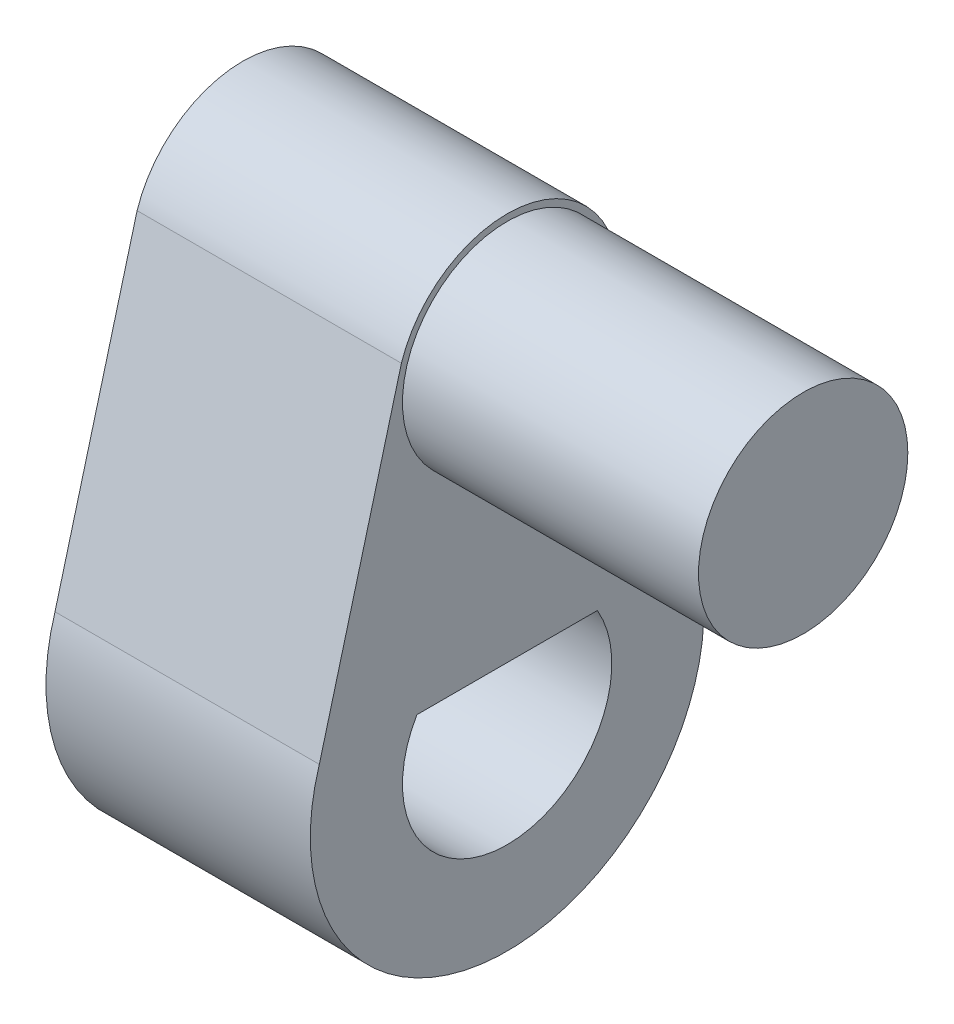
from build123d import *

# Parameters (mm, degrees)
BOSS_EXTRUDE2_DEPTH = 2.5
SKETCH4_R           = 0.99
CUT_EXTRUDE2_DEPTH  = 64.988660757
SKETCH6_R           = 0.99
BOSS_EXTRUDE4_DEPTH = 2.8
SKETCH7_W           = 2.01987101
SKETCH7_H           = 0.78494751
BOSS_EXTRUDE5_DEPTH = 2.5


with BuildPart() as part:
    # Sketch3 → Boss-Extrude2 (new body)
    with BuildSketch(Plane(origin=(0, 0, 0), x_dir=(0, 0, -1), z_dir=(1, 0, 0))):
        with BuildLine():
            Line((-54.67077374, 30.968825597), (-55.447230875, 28.071048118))
            ThreePointArc((-55.447230875, 28.071048118), (-53.67077374, 25.652507451), (-51.894316605, 28.071048118))
            Line((-51.894316605, 28.071048118), (-52.67077374, 30.968825597))
            ThreePointArc((-52.67077374, 30.968825597), (-53.67077374, 31.692969852), (-54.67077374, 30.968825597))
        make_face()
    extrude(amount=BOSS_EXTRUDE2_DEPTH)

    # Sketch4 → Cut-Extrude2 (cut, through all)
    with BuildSketch(Plane(origin=(2.5, 0, 0), x_dir=(0, 0, -1), z_dir=(1, 0, 0))):
        with Locations((-53.67077374, 27.514195996)):
            Circle(SKETCH4_R)
    extrude(amount=-CUT_EXTRUDE2_DEPTH, mode=Mode.SUBTRACT)

    # Sketch6 → Boss-Extrude4 (add)
    with BuildSketch(Plane(origin=(2.5, 0, 0), x_dir=(0, 0, -1), z_dir=(1, 0, 0))):
        with Locations((-53.67077374, 30.640427563)):
            Circle(SKETCH6_R)
    extrude(amount=BOSS_EXTRUDE4_DEPTH)

    # Sketch7 → Boss-Extrude5 (add)
    with BuildSketch(Plane(origin=(2.5, 0, 0), x_dir=(0, 0, -1), z_dir=(1, 0, 0))):
        with Locations((-53.657499813, 28.408869671)):
            Rectangle(SKETCH7_W, SKETCH7_H)
    extrude(amount=-BOSS_EXTRUDE5_DEPTH)


solid = part.part
